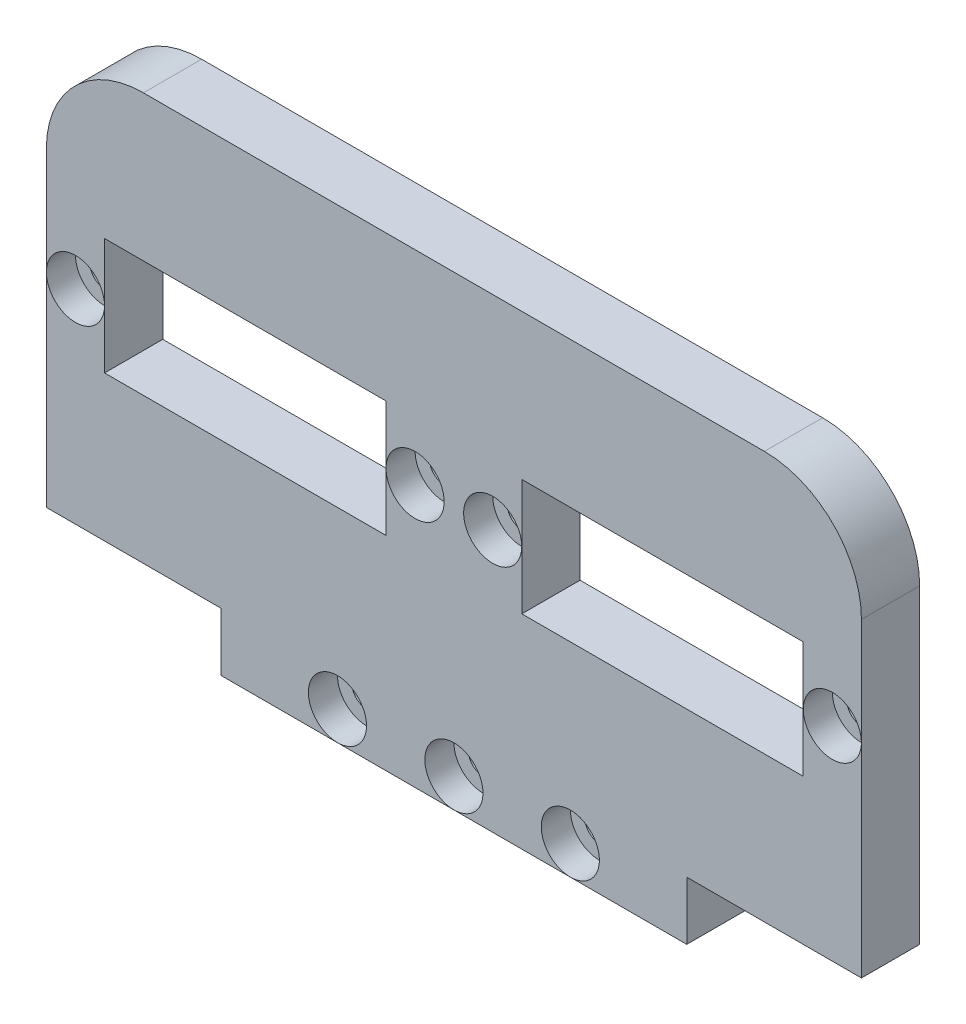
from build123d import *

# Parameters (mm, degrees)
ESQUISSE2_W             = 84
ESQUISSE2_H             = 48
BOSS_EXTRU_1_DEPTH      = 6
ESQUISSE3_R             = 1.5
ESQUISSE3_W             = 18
ESQUISSE3_H             = 6
ESQUISSE3_W_2           = 29
ESQUISSE3_H_2           = 12
ENL_V_MAT_EXTRU_1_DEPTH = 6
ESQUISSE4_R             = 2.995
ENL_V_MAT_EXTRU_2_DEPTH = 3
CONG_1_R                = 10


with BuildPart() as part:
    # Esquisse2 → Boss.-Extru.1 (new body)
    with BuildSketch(Plane.XY):
        with Locations((10.587382635, 10.131926121)):
            Rectangle(ESQUISSE2_W, ESQUISSE2_H)
    extrude(amount=BOSS_EXTRU_1_DEPTH)

    # Esquisse3 → Enlèv. mat.-Extru.1 (cut)
    with BuildSketch(Plane.XY.offset(6)):
        with Locations((-28.412617365, 13.131926121)):
            Circle(ESQUISSE3_R)
        with Locations((49.587382635, 13.131926121)):
            Circle(ESQUISSE3_R)
        with Locations((6.587382635, 13.131926121)):
            Circle(ESQUISSE3_R)
        with Locations((14.587382635, 13.131926121)):
            Circle(ESQUISSE3_R)
        with Locations((-1.412617365, -10.868073879)):
            Circle(ESQUISSE3_R)
        with Locations(Location((22.587382635, -10.868073879, 0), (0, 0, 180))):
            Circle(ESQUISSE3_R)
        with Locations((10.587382635, -10.868073879)):
            Circle(ESQUISSE3_R)
        with Locations((-22.412617365, -10.868073879)):
            Rectangle(ESQUISSE3_W, ESQUISSE3_H)
        with Locations((43.587382635, -10.868073879)):
            Rectangle(ESQUISSE3_W, ESQUISSE3_H)
        with Locations((-10.912617365, 13.131926121)):
            Rectangle(ESQUISSE3_W_2, ESQUISSE3_H_2)
        with Locations((32.087382635, 13.131926121)):
            Rectangle(ESQUISSE3_W_2, ESQUISSE3_H_2)
    extrude(amount=-ENL_V_MAT_EXTRU_1_DEPTH, mode=Mode.SUBTRACT)

    # Esquisse4 → Enlèv. mat.-Extru.2 (cut)
    with BuildSketch(Plane.XY.offset(6)):
        with Locations((-1.412617365, -10.868073879)):
            Circle(ESQUISSE4_R)
        with Locations((22.587382635, -10.868073879)):
            Circle(ESQUISSE4_R)
        with Locations((10.587382635, -10.868073879)):
            Circle(ESQUISSE4_R)
        with Locations((-28.412617365, 13.131926121)):
            Circle(ESQUISSE4_R)
        with Locations((6.587382635, 13.131926121)):
            Circle(ESQUISSE4_R)
        with Locations((14.587382635, 13.131926121)):
            Circle(ESQUISSE4_R)
        with Locations((49.587382635, 13.131926121)):
            Circle(ESQUISSE4_R)
    extrude(amount=-ENL_V_MAT_EXTRU_2_DEPTH, mode=Mode.SUBTRACT)

    # Congé1
    cong_1_edges = [part.edges().sort_by_distance(p)[0] for p in [
        (-31.412617365, 34.131926121, 3),
        (52.587382635, 34.131926121, 3),
    ]]
    fillet(cong_1_edges, radius=CONG_1_R)


solid = part.part
